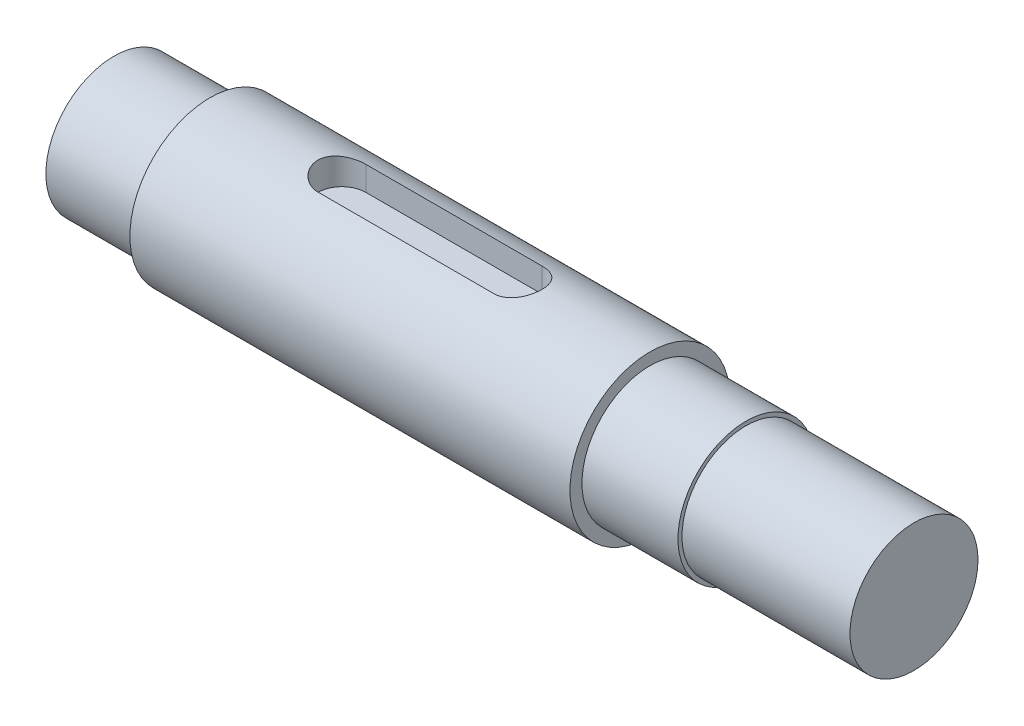
from build123d import *

# Parameters (mm, degrees)
CUT_EXTRUDE_START   = 6.5
CUT_EXTRUDE_1_DEPTH = 95.495049384


with BuildPart() as part:
    # Эскиз1 → Повернуть1 (revolve)
    with BuildSketch(Plane.XY, mode=Mode.PRIVATE) as revolve_1_sk:
        Polygon((0, 0), (0, 8.5), (12, 8.5), (12, 10), (67, 10), (67, 8.5), (79, 8.5), (79, 8), (100, 8), (100, 0), align=None)
    revolve(revolve_1_sk.sketch.rotate(Axis((100, 0, 0), (-1, 0, 0)), 90), axis=Axis((100, 0, 0), (-1, 0, 0)))

    # Эскиз2 → Вырез-Вытянуть1 (cut, through all)
    with BuildSketch(Plane(origin=(0, 0, 0), x_dir=(1, 0, 0), z_dir=(0, 1, 0)).offset(CUT_EXTRUDE_START)):
        with BuildLine():
            Line((28.5, 3), (50.5, 3))
            ThreePointArc((50.5, 3), (53.5, 0), (50.5, -3))
            Line((50.5, -3), (28.5, -3))
            ThreePointArc((28.5, -3), (25.5, 0), (28.5, 3))
        make_face()
    extrude(amount=CUT_EXTRUDE_1_DEPTH, mode=Mode.SUBTRACT)


solid = part.part
